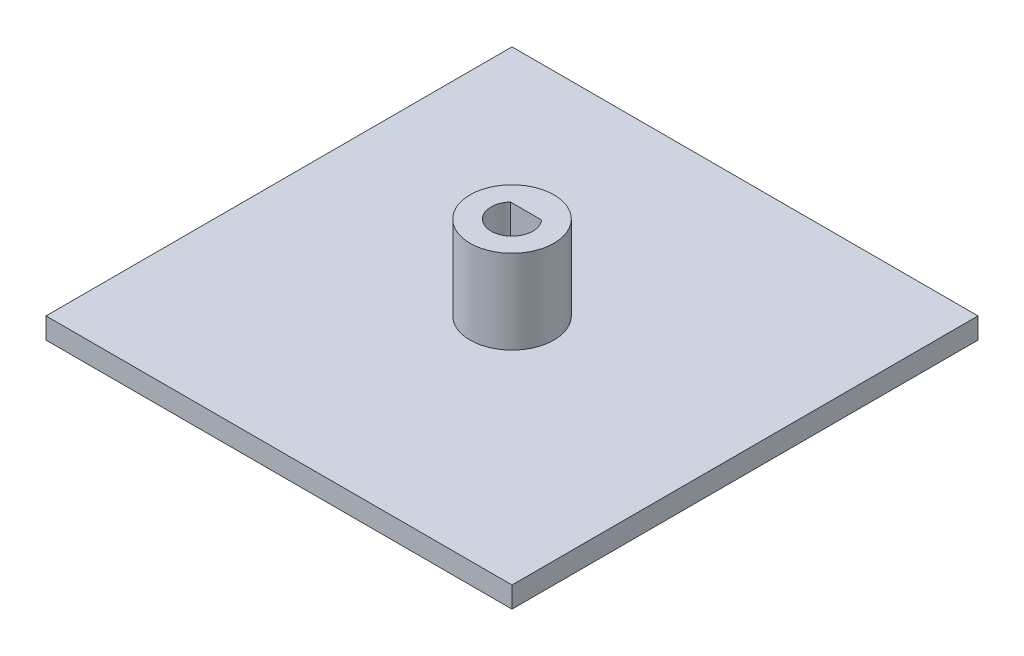
from build123d import *

# Parameters (mm, degrees)
SKETCH_1_W          = 33.333333334
SKETCH_1_H          = 33.333333334
EXTRUDE_1_DEPTH     = 1.5
SKETCH_2_R          = 3
EXTRUDE_2_DEPTH     = 6
CUT_EXTRUDE_1_DEPTH = 6


with BuildPart() as part:
    # 草图1 → 凸台-拉伸1 (new body)
    with BuildSketch(Plane(origin=(0, 0, 0), x_dir=(1, 0, 0), z_dir=(0, 1, 0))):
        Rectangle(SKETCH_1_W, SKETCH_1_H)
    extrude(amount=EXTRUDE_1_DEPTH)

    # 草图2 → 凸台-拉伸2 (add)
    with BuildSketch(Plane(origin=(0, 1.5, 0), x_dir=(1, 0, 0), z_dir=(0, 1, 0))):
        with Locations(Location((0, 0, 0), (0, 0, 270))):
            Circle(SKETCH_2_R)
    extrude(amount=EXTRUDE_2_DEPTH)

    # 草图3 → 切除-拉伸1 (cut)
    with BuildSketch(Plane(origin=(0, 7.5, 0), x_dir=(1, 0, 0), z_dir=(0, 1, 0))):
        with BuildLine():
            Line((-1.118033989, 1), (1.118033989, 1))
            ThreePointArc((1.118033989, 1), (0, -1.5), (-1.118033989, 1))
        make_face()
    extrude(amount=-CUT_EXTRUDE_1_DEPTH, mode=Mode.SUBTRACT)


solid = part.part
